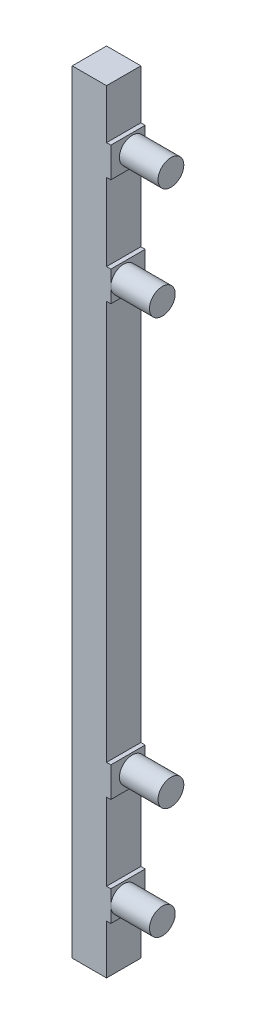
from build123d import *

# Parameters (mm, degrees)
SKETCH1_W           = 8
SKETCH1_H           = 180
BOSS_EXTRUDE1_DEPTH = 8
SKETCH3_R           = 3
BOSS_EXTRUDE4_DEPTH = 10
SKETCH3_4_W         = 8
SKETCH3_4_H         = 7
SKETCH3_4_R         = 3
BOSS_EXTRUDE5_DEPTH = 1


with BuildPart() as part:
    # Sketch1 → Boss-Extrude1 (new body)
    with BuildSketch(Plane(origin=(0, 0, 0), x_dir=(0, 0, -1), z_dir=(1, 0, 0))):
        Rectangle(SKETCH1_W, SKETCH1_H)
    extrude(amount=BOSS_EXTRUDE1_DEPTH)

    # Sketch3 → Boss-Extrude4 (add)
    with BuildSketch(Plane(origin=(8, 0, 0), x_dir=(0, 0, -1), z_dir=(1, 0, 0))):
        with Locations((1, 75)):
            Circle(SKETCH3_R)
        with Locations((-1, 50)):
            Circle(SKETCH3_R)
        with Locations((1, -50)):
            Circle(SKETCH3_R)
        with Locations((-1, -75)):
            Circle(SKETCH3_R)
    extrude(amount=BOSS_EXTRUDE4_DEPTH)

    # Sketch3<4> → Boss-Extrude5 (add)
    # profile 1 of 4: a face of its own
    with BuildSketch(Plane(origin=(8, 0, 0), x_dir=(0, 0, -1), z_dir=(1, 0, 0))):
        with Locations((0, 75)):
            Rectangle(SKETCH3_4_W, SKETCH3_4_H)
    # profile 2 of 4: a face of its own
    with BuildSketch(Plane(origin=(8, 0, 0), x_dir=(0, 0, -1), z_dir=(1, 0, 0))):
        with Locations((0, 50)):
            Rectangle(SKETCH3_4_W, SKETCH3_4_H)
    # profile 3 of 4: a face of its own
    with BuildSketch(Plane(origin=(8, 0, 0), x_dir=(0, 0, -1), z_dir=(1, 0, 0))):
        with Locations((0, -50)):
            Rectangle(SKETCH3_4_W, SKETCH3_4_H)
    # profile 4 of 4: a face of its own
    with BuildSketch(Plane(origin=(8, 0, 0), x_dir=(0, 0, -1), z_dir=(1, 0, 0))):
        Polygon((4, -71.5), (-4, -71.5), (-4, -74.999999954), (-4, -78.5), (4, -78.5), align=None)
        with Locations((-1, -75)):
            Circle(SKETCH3_4_R, mode=Mode.SUBTRACT)
    extrude(amount=BOSS_EXTRUDE5_DEPTH)


solid = part.part
